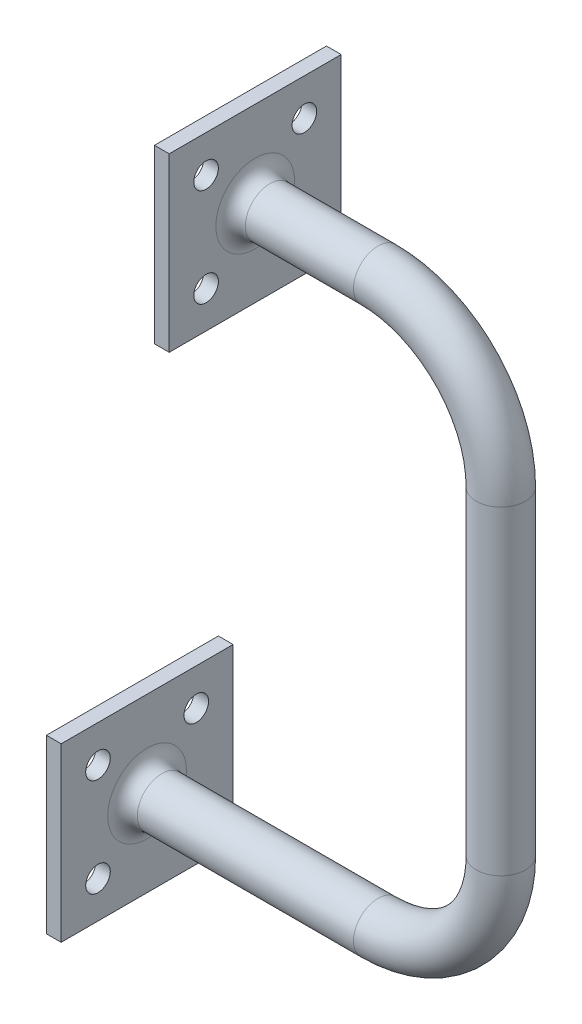
from build123d import *

# Parameters (mm, degrees)
SKETCH1_W            = 35
SKETCH1_H            = 35
BOSS_EXTRUDE1_DEPTH  = 3
SKETCH2_R            = 2.5
CUT_EXTRUDE1_DEPTH   = 25.929901725
LPATTERN1_COUNT      = 2
LPATTERN1_PITCH      = 20
LPATTERN1_COUNT_DIR2 = 2
LPATTERN1_PITCH_DIR2 = 20
SKETCH9_R            = 5
SKETCH10_W           = 35
SKETCH10_H           = 35
BOSS_EXTRUDE2_DEPTH  = 3
SKETCH11_R           = 2.5
CUT_EXTRUDE2_DEPTH   = 146.693169663
LPATTERN4_COUNT      = 2
LPATTERN4_PITCH      = 20
LPATTERN4_COUNT_DIR2 = 2
LPATTERN4_PITCH_DIR2 = 20
FILLET1_R            = 3
FILLET2_R            = 3


with BuildPart() as part:
    # Sketch1 → Boss-Extrude1 (new body)
    with BuildSketch(Plane(origin=(0, 0, 0), x_dir=(0, 0, -1), z_dir=(1, 0, 0))):
        Rectangle(SKETCH1_W, SKETCH1_H)
    extrude(amount=BOSS_EXTRUDE1_DEPTH)

    # Sketch2 → Cut-Extrude1 (cut, through all)
    with BuildSketch(Plane(origin=(3, 0, 0), x_dir=(0, 0, -1), z_dir=(1, 0, 0))):
        with Locations((10, 10)):
            Circle(SKETCH2_R)
    cut_extrude1 = extrude(amount=-CUT_EXTRUDE1_DEPTH, mode=Mode.SUBTRACT)

    # LPattern1: Cut-Extrude1 2 × 2
    with Locations(*[(0, -j * LPATTERN1_PITCH_DIR2, i * LPATTERN1_PITCH) for i in range(LPATTERN1_COUNT) for j in range(LPATTERN1_COUNT_DIR2) if (i, j) != (0, 0)]):
        add(cut_extrude1, mode=Mode.SUBTRACT)

    # Sweep1: sweep along a path in Sketch8
    with BuildLine(Plane.XY) as sweep1_path:
        Line((3, 0), (50, 0))
        ThreePointArc((50, 0), (67.677670206, 7.32233044), (75.000001, 25.0000005))
        Line((75.000001, 25.0000005), (75.000001, 90))
        ThreePointArc((75.000001, 90), (67.677670383, 107.677669883), (50.0000005, 115.0000005))
        Line((50.0000005, 115.0000005), (25.0000005, 115.0000005))
    # Sketch9 → Sweep1 (sweep)
    with BuildSketch(Plane(origin=(3, 0, 0), x_dir=(0, 0, -1), z_dir=(1, 0, 0))):
        Circle(SKETCH9_R)
    sweep(path=sweep1_path.line)

    # Sketch10 → Boss-Extrude2 (add)
    with BuildSketch(Plane(origin=(25.000002799, 5e-07, 0), x_dir=(0, 0, 1), z_dir=(-0.9999999999999998, -1.9990267318907433e-08, 0))):
        with Locations((0, 114.9999995)):
            Rectangle(SKETCH10_W, SKETCH10_H)
    extrude(amount=BOSS_EXTRUDE2_DEPTH)

    # Sketch11 → Cut-Extrude2 (cut, through all)
    with BuildSketch(Plane(origin=(22.000002799, 4.4e-07, 0), x_dir=(0, 0, 1), z_dir=(-0.9999999999999998, -1.999026737793079e-08, 0))):
        with Locations(Location((9.998977528, 124.998977028, 0), (0, 0, 270))):
            Circle(SKETCH11_R)
    cut_extrude2 = extrude(amount=-CUT_EXTRUDE2_DEPTH, mode=Mode.SUBTRACT)

    # LPattern4: Cut-Extrude2 2 × 2
    with Locations(*[(0, -j * LPATTERN4_PITCH_DIR2, -i * LPATTERN4_PITCH) for i in range(LPATTERN4_COUNT) for j in range(LPATTERN4_COUNT_DIR2) if (i, j) != (0, 0)]):
        add(cut_extrude2, mode=Mode.SUBTRACT)

    # Fillet1
    fillet1_edges = [part.edges().sort_by_distance(p)[0] for p in [
        (25.0000005, 115.0000005, 5),
    ]]
    fillet(fillet1_edges, radius=FILLET1_R)

    # Fillet2
    fillet2_edges = [part.edges().sort_by_distance(p)[0] for p in [
        (3, 0, 5),
    ]]
    fillet(fillet2_edges, radius=FILLET2_R)


solid = part.part
